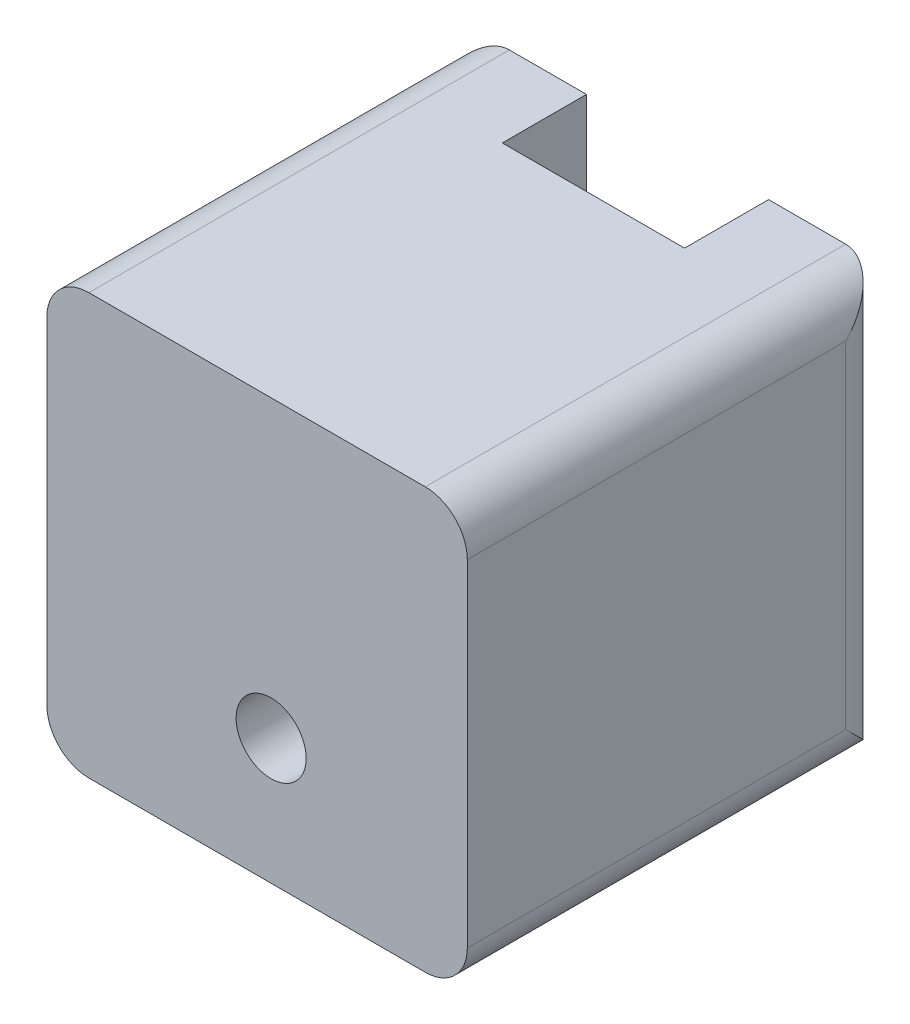
from build123d import *

# Parameters (mm, degrees)
ESQUISSE1_W              = 30
ESQUISSE1_H              = 30
BOSS_EXTRU_1_DEPTH       = 30
ESQUISSE2_W              = 13
ESQUISSE2_H              = 15
ENL_V_MAT_EXTRU_1_DEPTH  = 6
ESQUISSE3_W              = 3.5
ESQUISSE3_H              = 15
ENL_V_MAT_EXTRU_2_DEPTH  = 3
ESQUISSE4_R              = 2.5
ENL_V_MAT_EXTRU_18_DEPTH = 52.961524227
CONG_1_R                 = 3


with BuildPart() as part:
    # Esquisse1 → Boss.-Extru.1 (new body)
    with BuildSketch(Plane.XY):
        with Locations((-15, -15)):
            Rectangle(ESQUISSE1_W, ESQUISSE1_H)
    extrude(amount=BOSS_EXTRU_1_DEPTH)

    # Esquisse2 → Enlèv. mat.-Extru.1 (cut)
    with BuildSketch(Plane(origin=(0, 0, 0), x_dir=(-1, 0, 0), z_dir=(0, 0, -1))):
        with Locations((15, -7.5)):
            Rectangle(ESQUISSE2_W, ESQUISSE2_H)
    extrude(amount=-ENL_V_MAT_EXTRU_1_DEPTH, mode=Mode.SUBTRACT)

    # Esquisse3 → Enlèv. mat.-Extru.2 (cut)
    with BuildSketch(Plane(origin=(0, 0, 0), x_dir=(-1, 0, 0), z_dir=(0, 0, -1))):
        with Locations((19.75, -22.5)):
            Rectangle(ESQUISSE3_W, ESQUISSE3_H)
    extrude(amount=-ENL_V_MAT_EXTRU_2_DEPTH, mode=Mode.SUBTRACT)

    # Esquisse4 → Enlèv. mat.-Extru.18 (cut, through all)
    with BuildSketch(Plane(origin=(0, 0, 0), x_dir=(-1, 0, 0), z_dir=(0, 0, -1))):
        with Locations((14, -21.038960512)):
            Circle(ESQUISSE4_R)
    extrude(amount=-ENL_V_MAT_EXTRU_18_DEPTH, mode=Mode.SUBTRACT)

    # Congé1
    cong_1_edges = [part.edges().sort_by_distance(p)[0] for p in [
        (-30, -15, 0),
        (0, -15, 0),
        (0, -30, 15),
        (-30, -30, 15),
        (-30, 0, 15),
        (0, 0, 15),
    ]]
    fillet(cong_1_edges, radius=CONG_1_R)


solid = part.part
